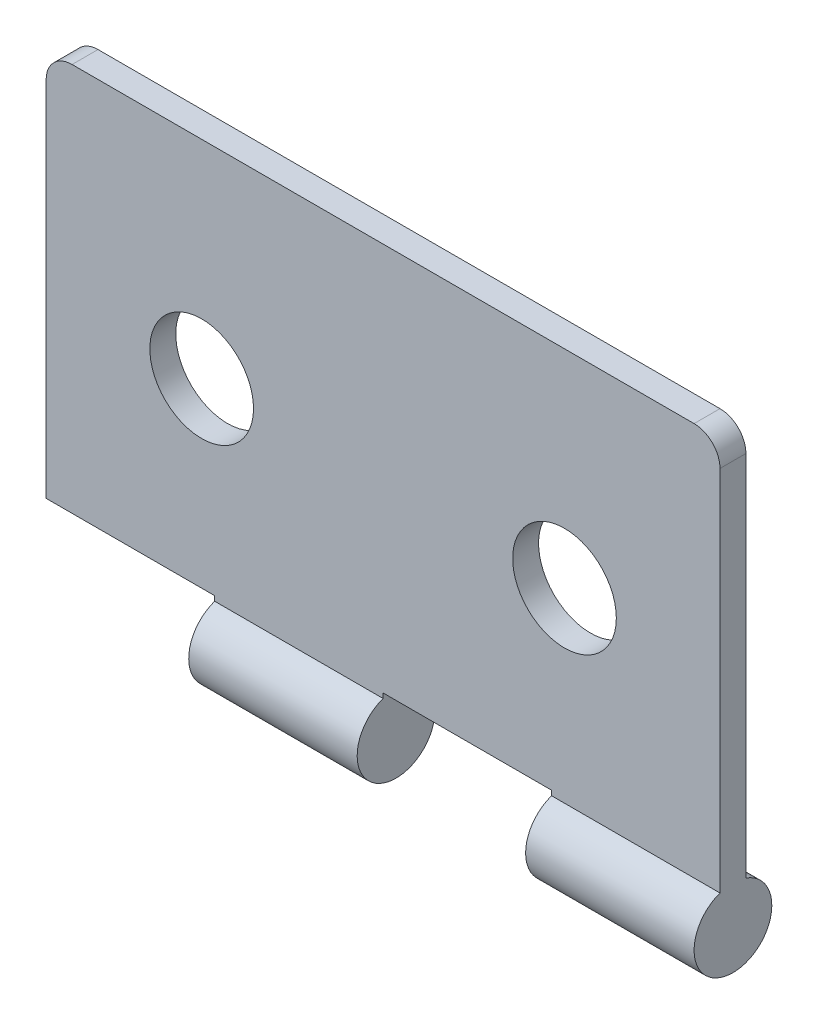
from build123d import *

# Parameters (mm, degrees)
SKETCH1_W               = 26
SKETCH1_H               = 15
SKETCH1_R               = 2
BOSS_EXTRUDE1_DEPTH     = 1
FILLET1_R               = 1
SKETCH3_R               = 1.5
BOSS_EXTRUDE2_DEPTH     = 26
BOSS_EXTRUDE3_REACH     = 32.083
SKETCH6_W               = 26
SKETCH6_H               = 1
CUT_EXTRUDE1_DEPTH      = 31.083217913
CUT_EXTRUDE1_DEPTH_BACK = 31.083217913
SKETCH8_W               = 6.5
SKETCH8_H               = 3.1


with BuildPart() as part:
    # Sketch1 → Boss-Extrude1 (new body)
    with BuildSketch(Plane.XY):
        with Locations((13, 7.5)):
            Rectangle(SKETCH1_W, SKETCH1_H)
        with Locations((6, 7)):
            Circle(SKETCH1_R, mode=Mode.SUBTRACT)
        with Locations((20, 7)):
            Circle(SKETCH1_R, mode=Mode.SUBTRACT)
    extrude(amount=BOSS_EXTRUDE1_DEPTH)

    # Fillet1
    fillet1_edges = [part.edges().sort_by_distance(p)[0] for p in [
        (0, 15, 0.5),
        (26, 15, 0.5),
    ]]
    fillet(fillet1_edges, radius=FILLET1_R)


with BuildPart() as body_2:
    # Sketch3 → Boss-Extrude2 (new body)
    with BuildSketch(Plane(origin=(0, 0, 0), x_dir=(0, 0, -1), z_dir=(1, 0, 0))):
        with Locations(Location((-0.5, -1.6, 0), (0, 0, 180))):
            Circle(SKETCH3_R)
    extrude(amount=BOSS_EXTRUDE2_DEPTH)

    # Sketch6 → Boss-Extrude3 (add, up to next)
    with BuildSketch(Plane.XZ, mode=Mode.PRIVATE) as boss_extrude3_sk1:
        with Locations((13, 0.5)):
            Rectangle(SKETCH6_W, SKETCH6_H)
    boss_extrude3_tool1 = extrude(boss_extrude3_sk1.sketch, amount=BOSS_EXTRUDE3_REACH, mode=Mode.PRIVATE) - body_2.part

    add(part.part)  # Boss-Extrude3 merges part
    add(boss_extrude3_tool1.solids().sort_by_distance((13, 0, 0.5))[0])

    # Sketch8 → Cut-Extrude1 (cut, two sides: drawn at the far end of the back side and taken through both)
    with BuildSketch(Plane.XY.offset(-CUT_EXTRUDE1_DEPTH_BACK)):
        with Locations((3.25, -1.55)):
            Rectangle(SKETCH8_W, SKETCH8_H)
        with Locations((16.25, -1.55)):
            Rectangle(SKETCH8_W, SKETCH8_H)
    extrude(amount=CUT_EXTRUDE1_DEPTH + CUT_EXTRUDE1_DEPTH_BACK, mode=Mode.SUBTRACT)


solid = body_2.part
